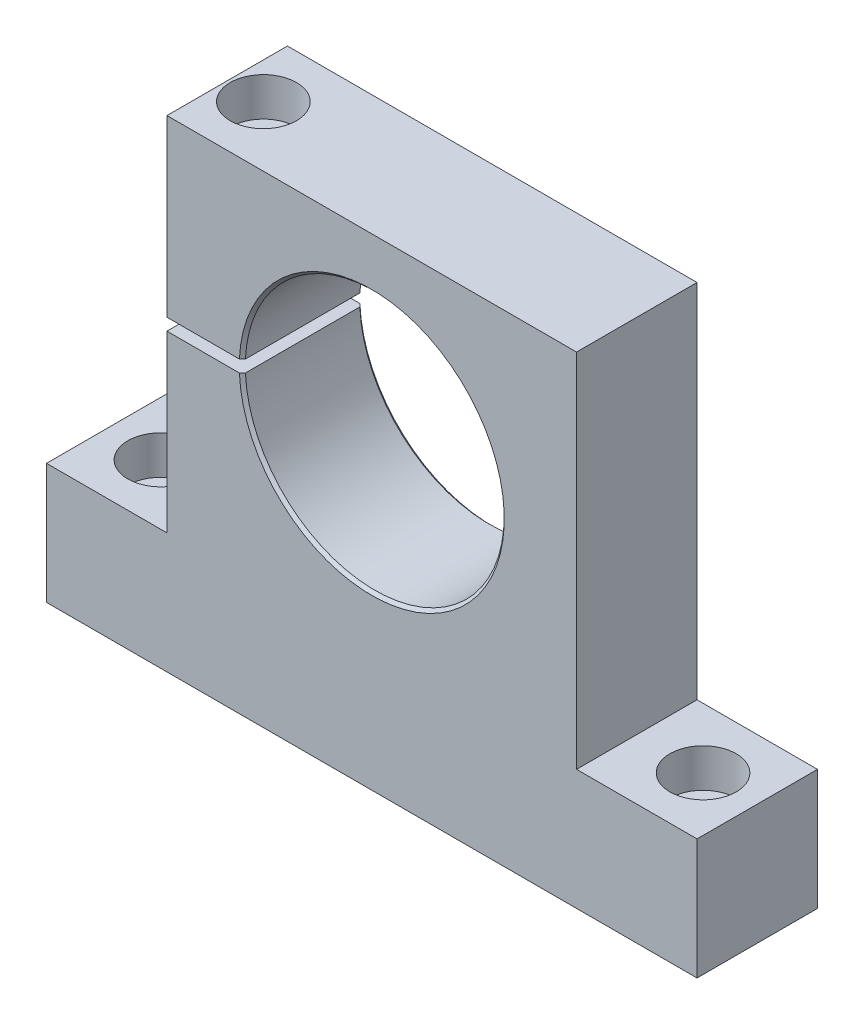
from build123d import *

# Parameters (mm, degrees)
SCHIZZO1_R                                           = 21.5
ESTRUSIONE_ESTRUSIONE1_DEPTH                         = 20
FORO_LAMATO_PER_VITE_M6_A_TESTA_CILINDRI_D           = 6.6
FORO_LAMATO_PER_VITE_M6_A_TESTA_CILINDRI_CBORE_D     = 11
FORO_LAMATO_PER_VITE_M6_A_TESTA_CILINDRI_CBORE_DEPTH = 6.4
CBORE_FOR_M6_HEX_SOCKET_HEAD_CAP_SCREW1_D            = 6.6
CBORE_FOR_M6_HEX_SOCKET_HEAD_CAP_SCREW1_DEPTH        = 50
CBORE_FOR_M6_HEX_SOCKET_HEAD_CAP_SCREW1_CBORE_D      = 11
CBORE_FOR_M6_HEX_SOCKET_HEAD_CAP_SCREW1_CBORE_DEPTH  = 6.4
CBORE_FOR_M6_HEX_SOCKET_HEAD_CAP_SCREW1_TIP          = 1.982840043
SCHIZZO7_W                                           = 15.52137419
SCHIZZO7_H                                           = 2
TAGLIO_ESTRUSIONE1_DEPTH                             = 136.882302012
CHAMFER1_SIZE                                        = 0.5
CHAMFER2_SIZE                                        = 0.5


with BuildPart() as part:
    # Schizzo1 → Estrusione-Estrusione1 (new body)
    with BuildSketch(Plane.XY):
        Polygon((0, 0), (108, 0), (108, 20), (88, 20), (88, 80), (20, 80), (20, 20), (0, 20), align=None)
        with Locations((54, 50)):
            Circle(SCHIZZO1_R, mode=Mode.SUBTRACT)
    extrude(amount=ESTRUSIONE_ESTRUSIONE1_DEPTH)

    # Foro lamato per Vite M6 a testa cilindrica-1 (through all)
    with Locations(Plane(origin=(9, 20, 10), x_dir=(0, 0, 1), z_dir=(0, 1, 0))):
        with Locations((0, 0), (0, 90)):
            CounterBoreHole(FORO_LAMATO_PER_VITE_M6_A_TESTA_CILINDRI_D / 2, FORO_LAMATO_PER_VITE_M6_A_TESTA_CILINDRI_CBORE_D / 2, FORO_LAMATO_PER_VITE_M6_A_TESTA_CILINDRI_CBORE_DEPTH)

    # CBORE for M6 Hex Socket Head Cap Screw1
    with Locations(Plane(origin=(26, 80, 10), x_dir=(0, 0, 1), z_dir=(0, 1, 0))):
        with Locations((0, 0)):
            CounterBoreHole(CBORE_FOR_M6_HEX_SOCKET_HEAD_CAP_SCREW1_D / 2, CBORE_FOR_M6_HEX_SOCKET_HEAD_CAP_SCREW1_CBORE_D / 2, CBORE_FOR_M6_HEX_SOCKET_HEAD_CAP_SCREW1_CBORE_DEPTH, depth=CBORE_FOR_M6_HEX_SOCKET_HEAD_CAP_SCREW1_DEPTH)
            with Locations((0, 0, -(CBORE_FOR_M6_HEX_SOCKET_HEAD_CAP_SCREW1_DEPTH + CBORE_FOR_M6_HEX_SOCKET_HEAD_CAP_SCREW1_TIP / 2))):  # 118° drill point
                Cone(0, CBORE_FOR_M6_HEX_SOCKET_HEAD_CAP_SCREW1_D / 2, CBORE_FOR_M6_HEX_SOCKET_HEAD_CAP_SCREW1_TIP, mode=Mode.SUBTRACT)

    # Schizzo7 → Taglio-Estrusione1 (cut, through all)
    with BuildSketch(Plane(origin=(0, 0, 0), x_dir=(-1, 0, 0), z_dir=(0, 0, -1))):
        with Locations((-27.66540179, 50)):
            Rectangle(SCHIZZO7_W, SCHIZZO7_H)
    extrude(amount=-TAGLIO_ESTRUSIONE1_DEPTH, mode=Mode.SUBTRACT)

    # Chamfer1
    chamfer1_edges = [part.edges().sort_by_distance(p)[0] for p in [
        (54.500135336, 71.494182112, 0),
    ]]
    chamfer(chamfer1_edges, length=CHAMFER1_SIZE)

    # Chamfer2
    chamfer2_edges = [part.edges().sort_by_distance(p)[0] for p in [
        (54.500135336, 28.505817888, 20),
    ]]
    chamfer(chamfer2_edges, length=CHAMFER2_SIZE)


solid = part.part
